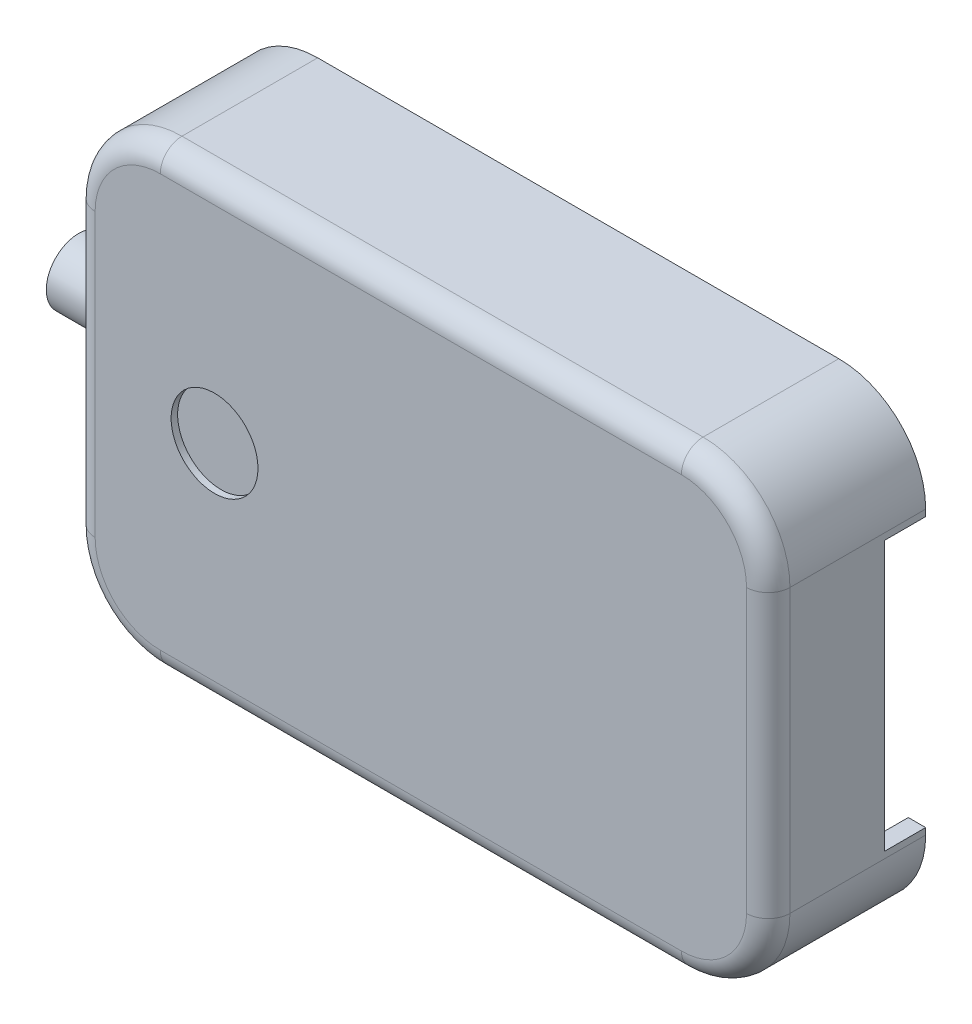
from build123d import *

# Parameters (mm, degrees)
SKETCH1_W           = 64
SKETCH1_H           = 42
BOSS_EXTRUDE1_DEPTH = 14.5
FILLET1_R           = 8
FILLET2_R           = 2
SHELL1_T            = -1.6
CUT_EXTRUDE1_REACH  = 70.9
SKETCH2_W           = 3.8
SKETCH2_H           = 24.8
SKETCH3_R           = 3
BOSS_EXTRUDE2_DEPTH = 7.000000018
CUT_EXTRUDE2_REACH  = 77.447
SKETCH4_R           = 1.6
SKETCH5_R           = 4
CUT_EXTRUDE3_DEPTH  = 0.6


with BuildPart() as part:
    # Sketch1 → Boss-Extrude1 (new body)
    with BuildSketch(Plane.XY):
        Rectangle(SKETCH1_W, SKETCH1_H)
    extrude(amount=BOSS_EXTRUDE1_DEPTH)

    # Fillet1
    fillet1_edges = [part.edges().sort_by_distance(p)[0] for p in [
        (-32, 21, 7.25),
        (32, 21, 7.25),
        (32, -21, 7.25),
        (-32, -21, 7.25),
    ]]
    fillet(fillet1_edges, radius=FILLET1_R)

    # Fillet2
    fillet2_edges = [part.edges().sort_by_distance(p)[0] for p in [
        (0, -21, 14.5),
        (-32, 0, 14.5),
        (32, 0, 14.5),
        (0, 21, 14.5),
        (29.656854249, 18.656854249, 14.5),
        (-29.656854249, 18.656854249, 14.5),
        (29.656854249, -18.656854249, 14.5),
        (-29.656854249, -18.656854249, 14.5),
    ]]
    fillet(fillet2_edges, radius=FILLET2_R)

    # Shell1
    shell1_openings = [part.faces().sort_by_distance(p)[0] for p in [
        (0, 0, 0),
    ]]
    offset(amount=SHELL1_T, openings=shell1_openings, kind=Kind.INTERSECTION)

    # Sketch2 → Cut-Extrude1 (cut, up to next)
    with BuildSketch(Plane(origin=(32, 0, 0), x_dir=(0, 0, -1), z_dir=(1, 0, 0)), mode=Mode.PRIVATE) as cut_extrude1_sk1:
        with Locations((-1.9, 0)):
            Rectangle(SKETCH2_W, SKETCH2_H)
    cut_extrude1_tool1 = extrude(cut_extrude1_sk1.sketch, amount=-CUT_EXTRUDE1_REACH, mode=Mode.PRIVATE) & part.part
    add(cut_extrude1_tool1.solids().sort_by_distance((32, 0, 1.9))[0], mode=Mode.SUBTRACT)

    # Sketch3 → Boss-Extrude2 (add)
    with BuildSketch(Plane.ZY.offset(32)):
        with Locations(Location((7, 0, 0), (0, 0, 180))):
            Circle(SKETCH3_R)
    extrude(amount=BOSS_EXTRUDE2_DEPTH)

    # Sketch4 → Cut-Extrude2 (cut, up to next)
    with BuildSketch(Plane.ZY.offset(39.000000018), mode=Mode.PRIVATE) as cut_extrude2_sk1:
        with Locations((7, 0)):
            Circle(SKETCH4_R)
    cut_extrude2_tool1 = extrude(cut_extrude2_sk1.sketch, amount=-CUT_EXTRUDE2_REACH, mode=Mode.PRIVATE) & part.part
    add(cut_extrude2_tool1.solids().sort_by_distance((-39, 0, 7))[0], mode=Mode.SUBTRACT)

    # Sketch5 → Cut-Extrude3 (cut)
    with BuildSketch(Plane.XY.offset(14.5)):
        with Locations((-19, 0)):
            Circle(SKETCH5_R)
    extrude(amount=-CUT_EXTRUDE3_DEPTH, mode=Mode.SUBTRACT)


solid = part.part
